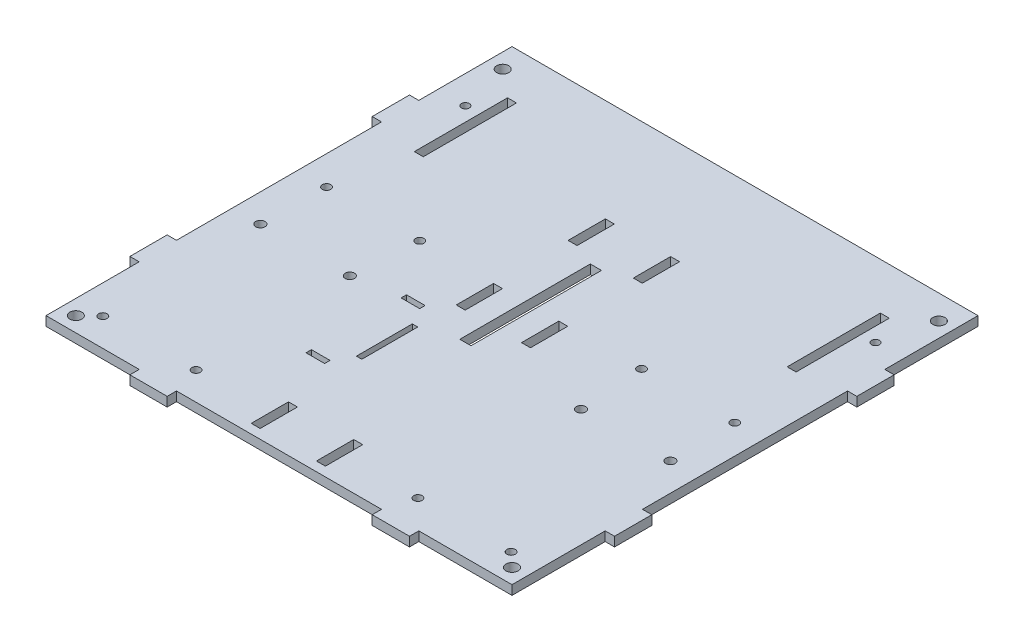
from build123d import *

# Parameters (mm, degrees)
SKETCH1_W                           = 250
SKETCH1_H                           = 250
SKETCH1_W_2                         = 4.8
SKETCH1_H_2                         = 20
SKETCH1_W_3                         = 10
SKETCH1_H_3                         = 2.9
SKETCH1_W_4                         = 2.9
SKETCH1_H_4                         = 30
SKETCH1_H_5                         = 50
SKETCH1_W_5                         = 6
SKETCH1_H_6                         = 70
BOSS_EXTRUDE1_DEPTH                 = 5
SKETCH2_R                           = 2.5
CUT_EXTRUDE1_DEPTH                  = 354.588744165
SKETCH3_R                           = 3.25
CUT_EXTRUDE2_DEPTH                  = 354.588744165
SKETCH4_W                           = 5
SKETCH4_H                           = 20
SKETCH4_W_2                         = 20
SKETCH4_H_2                         = 5
BOSS_EXTRUDE2_DEPTH                 = 5
F_4_5_4_5_DIAMETER_HOLE1_AT_2_COUNT = 2
F_4_5_4_5_DIAMETER_HOLE1_AT_2_PITCH = 50
F_4_5_4_5_DIAMETER_HOLE1_AT_3_COUNT = 2
F_4_5_4_5_DIAMETER_HOLE1_AT_3_PITCH = 130
F_4_5_4_5_DIAMETER_HOLE1_AT_4_COUNT = 2
F_4_5_4_5_DIAMETER_HOLE1_AT_4_PITCH = 120
SKETCH9_W                           = 4.8
SKETCH9_H                           = 20
CUT_EXTRUDE3_DEPTH                  = 358.141428569
SKETCH10_R                          = 2.1
CUT_EXTRUDE4_DEPTH                  = 5


with BuildPart() as part:
    # Sketch1 → Boss-Extrude1 (new body)
    with BuildSketch(Plane(origin=(0, 0, 0), x_dir=(1, 0, 0), z_dir=(0, 1, 0))):
        with Locations((125, 125)):
            Rectangle(SKETCH1_W, SKETCH1_H)
        with Locations((142.5, 15)):
            Rectangle(SKETCH1_W_2, SKETCH1_H_2, mode=Mode.SUBTRACT)
        with Locations((107.5, 15)):
            Rectangle(SKETCH1_W_2, SKETCH1_H_2, mode=Mode.SUBTRACT)
        with Locations((92, 53.93422616)):
            Rectangle(SKETCH1_W_3, SKETCH1_H_3, mode=Mode.SUBTRACT)
        with Locations((103.55, 79.434226159)):
            Rectangle(SKETCH1_W_4, SKETCH1_H_4, mode=Mode.SUBTRACT)
        with Locations((92, 104.93422616)):
            Rectangle(SKETCH1_W_3, SKETCH1_H_3, mode=Mode.SUBTRACT)
        with Locations((107.5, 125)):
            Rectangle(SKETCH1_W_2, SKETCH1_H_2, mode=Mode.SUBTRACT)
        with Locations((142.5, 125)):
            Rectangle(SKETCH1_W_2, SKETCH1_H_2, mode=Mode.SUBTRACT)
        with Locations((225, 200)):
            Rectangle(SKETCH1_W_2, SKETCH1_H_5, mode=Mode.SUBTRACT)
        with Locations((125, 135)):
            Rectangle(SKETCH1_W_5, SKETCH1_H_6, mode=Mode.SUBTRACT)
        with Locations((25, 200)):
            Rectangle(SKETCH1_W_2, SKETCH1_H_5, mode=Mode.SUBTRACT)
    extrude(amount=BOSS_EXTRUDE1_DEPTH)

    # Sketch2 → Cut-Extrude1 (cut, through all)
    with BuildSketch(Plane(origin=(0, 5, 0), x_dir=(1, 0, 0), z_dir=(0, 1, 0))):
        with Locations(Location((15, 100, 0), (0, 0, 270))):
            Circle(SKETCH2_R)
        with Locations(Location((63, 100, 0), (0, 0, 270))):
            Circle(SKETCH2_R)
    cut_extrude1 = extrude(amount=-CUT_EXTRUDE1_DEPTH, mode=Mode.SUBTRACT)

    # Sketch3 → Cut-Extrude2 (cut, through all)
    with BuildSketch(Plane(origin=(0, 5, 0), x_dir=(1, 0, 0), z_dir=(0, 1, 0))):
        with Locations(Location((8, 8, 0), (0, 0, 270))):
            Circle(SKETCH3_R)
        with Locations(Location((8, 237, 0), (0, 0, 270))):
            Circle(SKETCH3_R)
    cut_extrude2 = extrude(amount=-CUT_EXTRUDE2_DEPTH, mode=Mode.SUBTRACT)

    # Mirror1: Cut-Extrude2 across plane
    add(cut_extrude2.mirror(Plane.ZY.offset(-125)), mode=Mode.SUBTRACT)

    # Sketch4 → Boss-Extrude2 (add)
    with BuildSketch(Plane(origin=(0, 5, 0), x_dir=(1, 0, 0), z_dir=(0, 1, 0))):
        with Locations((-2.5, 190)):
            Rectangle(SKETCH4_W, SKETCH4_H)
        with Locations((-2.5, 60)):
            Rectangle(SKETCH4_W, SKETCH4_H)
        with Locations((60, -2.5)):
            Rectangle(SKETCH4_W_2, SKETCH4_H_2)
    boss_extrude2 = extrude(amount=-BOSS_EXTRUDE2_DEPTH)

    # Mirror2: Boss-Extrude2 across plane
    add(boss_extrude2.mirror(Plane.ZY.offset(-125)))

    # Mirror3: Cut-Extrude1 across plane
    add(cut_extrude1.mirror(Plane.ZY.offset(-125)), mode=Mode.SUBTRACT)

    # Sketch6 → Ø4.5 (4.5) Diameter Hole1 (revolve, cut)
    with BuildSketch(Plane(origin=(15.5, 5, -135), x_dir=(0, 0, 1), z_dir=(1, 0, 0))):
        Polygon((0, 0), (0, 11.351936393), (2.25, 10), (2.25, 0), align=None)
    f_4_5_4_5_diameter_hole1 = revolve(axis=Axis((15.5, 11.35, -135), (0, -1, 0)), mode=Mode.SUBTRACT)

    # Ø4.5 (4.5) Diameter Hole1 at 2: Ø4.5 (4.5) Diameter Hole1 ×2
    with Locations(*[(i * F_4_5_4_5_DIAMETER_HOLE1_AT_2_PITCH, 0, 0) for i in range(1, F_4_5_4_5_DIAMETER_HOLE1_AT_2_COUNT)]):
        add(f_4_5_4_5_diameter_hole1, mode=Mode.SUBTRACT)

    # Ø4.5 (4.5) Diameter Hole1 at 3: Ø4.5 (4.5) Diameter Hole1 ×2
    with Locations(*[Vector(0.38461538461538475, 0, 0.9230769230769231) * (i * F_4_5_4_5_DIAMETER_HOLE1_AT_3_PITCH) for i in range(1, F_4_5_4_5_DIAMETER_HOLE1_AT_3_COUNT)]):
        add(f_4_5_4_5_diameter_hole1, mode=Mode.SUBTRACT)

    # Ø4.5 (4.5) Diameter Hole1 at 4: Ø4.5 (4.5) Diameter Hole1 ×2
    with Locations(*[(0, 0, i * F_4_5_4_5_DIAMETER_HOLE1_AT_4_PITCH) for i in range(1, F_4_5_4_5_DIAMETER_HOLE1_AT_4_COUNT)]):
        add(f_4_5_4_5_diameter_hole1, mode=Mode.SUBTRACT)

    # Mirror4: Ø4.5 (4.5) Diameter Hole1 across plane
    add(f_4_5_4_5_diameter_hole1.mirror(Plane.ZY.offset(-125)), mode=Mode.SUBTRACT)

    # Mirror4 copy 1 sketch → Mirror4 copy 1 (revolve, cut)
    with BuildSketch(Plane(origin=(184.5, 5, -135), x_dir=(0, 0, 1), z_dir=(-1, 0, 0))):
        Polygon((0, 0), (0, -11.351936393), (2.25, -10), (2.25, 0), align=None)
    revolve(axis=Axis((184.5, 11.35, -135), (0, 1, 0)), mode=Mode.SUBTRACT)

    # Mirror4 copy 2 sketch → Mirror4 copy 2 (revolve, cut)
    with BuildSketch(Plane(origin=(184.5, 5, -15), x_dir=(0, 0, 1), z_dir=(-1, 0, 0))):
        Polygon((0, 0), (0, -11.351936393), (2.25, -10), (2.25, 0), align=None)
    revolve(axis=Axis((184.5, 11.35, -15), (0, 1, 0)), mode=Mode.SUBTRACT)

    # Mirror4 copy 3 sketch → Mirror4 copy 3 (revolve, cut)
    with BuildSketch(Plane(origin=(234.5, 5, -15), x_dir=(0, 0, 1), z_dir=(-1, 0, 0))):
        Polygon((0, 0), (0, -11.351936393), (2.25, -10), (2.25, 0), align=None)
    revolve(axis=Axis((234.5, 11.35, -15), (0, 1, 0)), mode=Mode.SUBTRACT)

    # Sketch9 → Cut-Extrude3 (cut, through all)
    with BuildSketch(Plane.XZ):
        with Locations((107.5, -185)):
            Rectangle(SKETCH9_W, SKETCH9_H)
    cut_extrude3 = extrude(amount=-CUT_EXTRUDE3_DEPTH, mode=Mode.SUBTRACT)

    # Mirror5: Cut-Extrude3 across plane
    add(cut_extrude3.mirror(Plane.ZY.offset(-125)), mode=Mode.SUBTRACT)

    # Sketch10 → Cut-Extrude4 (cut)
    with BuildSketch(Plane.XZ):
        with Locations(Location((15, -210, 0), (0, 0, 270))):
            Circle(SKETCH10_R)
        with Locations(Location((235, -210, 0), (0, 0, 270))):
            Circle(SKETCH10_R)
    extrude(amount=-CUT_EXTRUDE4_DEPTH, mode=Mode.SUBTRACT)


solid = part.part
